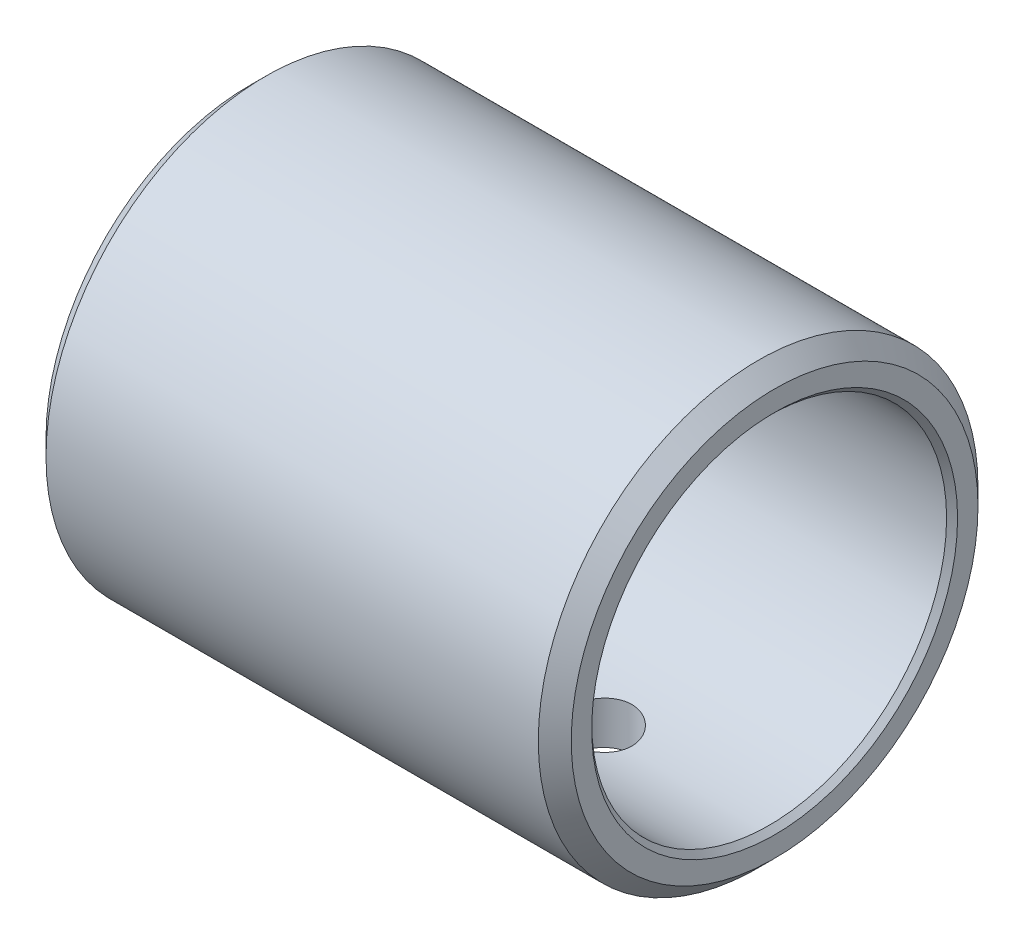
from build123d import *

# Parameters (mm, degrees)
SKETCH2_W          = 47.8
SKETCH2_H          = 3.8575
CHAMFER1_SIZE      = 1.5
CHAMFER2_SIZE      = 0.5
SKETCH3_R          = 3
CUT_EXTRUDE1_DEPTH = 56.546738091


with BuildPart() as part:
    # Sketch2 → Revolve1 (revolve)
    with BuildSketch(Plane.XY, mode=Mode.PRIVATE) as revolve1_sk:
        with Locations((-23.9, 18.07875)):
            Rectangle(SKETCH2_W, SKETCH2_H)
    revolve(revolve1_sk.sketch.rotate(Axis((0, 0, 0), (-1, 0, 0)), 90), axis=Axis((0, 0, 0), (-1, 0, 0)))

    # Chamfer1
    chamfer1_edges = [part.edges().sort_by_distance(p)[0] for p in [
        (-47.8, 0, 20.0075),
        (0, 0, 20.0075),
    ]]
    chamfer(chamfer1_edges, length=CHAMFER1_SIZE)

    # Chamfer2
    chamfer2_edges = [part.edges().sort_by_distance(p)[0] for p in [
        (-47.8, 0, 16.15),
        (0, 0, 16.15),
    ]]
    chamfer(chamfer2_edges, length=CHAMFER2_SIZE)

    # Sketch3 → Cut-Extrude1 (cut, through all)
    with BuildSketch(Plane(origin=(0, 0, 0), x_dir=(1, 0, 0), z_dir=(0, 1, 0))):
        with Locations(Location((-16, 0, 0), (0, 0, 270))):
            Circle(SKETCH3_R)
        with Locations(Location((-32, 0, 0), (0, 0, 270))):
            Circle(SKETCH3_R)
    extrude(amount=-CUT_EXTRUDE1_DEPTH, mode=Mode.SUBTRACT)


solid = part.part
